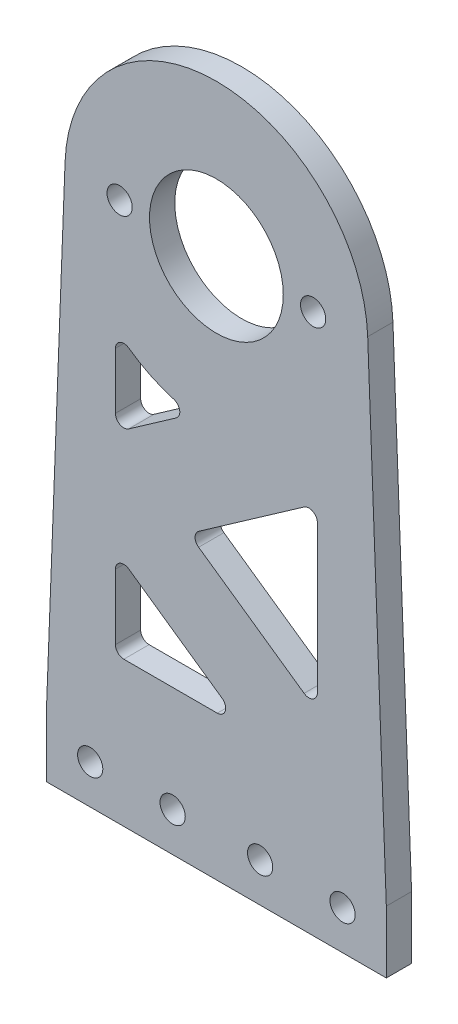
from build123d import *

# Parameters (mm, degrees)
SKETCH1_R               = 1.5
SKETCH1_R_2             = 7.95
MAIN_BODY_LINK_B1_DEPTH = 3
CUT_EXTRUDE1_REACH      = 168.945
CUT_EXTRUDE2_REACH      = 168.945
SKETCH3_R               = 1.5
FILLET1_R               = 1


with BuildPart() as part:
    # Sketch1 → Main Body Link B1 (new body)
    with BuildSketch(Plane.XY):
        with BuildLine():
            Line((-11.1, 83.474052381), (-9.1, 83.474052381))
            Line((-9.1, 83.474052381), (0, 83.474052381))
            Line((0, 83.474052381), (9.1, 83.474052381))
            Line((9.1, 83.474052381), (11.1, 83.474052381))
            Line((11.1, 83.474052381), (20.2, 83.474052381))
            Line((20.2, 83.474052381), (20.2, 90.874052381))
            Line((20.2, 90.874052381), (17.986683974, 148.383116621))
            ThreePointArc((17.986683974, 148.383116621), (0, 165.690874165), (-17.986683974, 148.383116621))
            Line((-17.986683974, 148.383116621), (-20.2, 90.874052381))
            Line((-20.2, 90.874052381), (-20.2, 83.474052381))
            Line((-20.2, 83.474052381), (-11.1, 83.474052381))
        make_face()
        with Locations((5.2, 88.124052381)):
            Circle(SKETCH1_R, mode=Mode.SUBTRACT)
        with Locations((15, 88.124052381)):
            Circle(SKETCH1_R, mode=Mode.SUBTRACT)
        with Locations((-15, 88.124052381)):
            Circle(SKETCH1_R, mode=Mode.SUBTRACT)
        with Locations((-5.2, 88.124052381)):
            Circle(SKETCH1_R, mode=Mode.SUBTRACT)
        with Locations((0, 147.690874165)):
            Circle(SKETCH1_R_2, mode=Mode.SUBTRACT)
    extrude(amount=MAIN_BODY_LINK_B1_DEPTH)

    # Sketch2 → Cut-Extrude1 (cut, up to next)
    with BuildSketch(Plane.XY.offset(3), mode=Mode.PRIVATE) as cut_extrude1_sk1:
        with BuildLine():
            ThreePointArc((-2.929911079, 129.930929878), (-7.774454217, 131.456408925), (-12, 134.2744663))
            Line((-12, 134.2744663), (-12, 123.584968066))
            Line((-12, 123.584968066), (-2.929911079, 129.930929878))
        make_face()
    cut_extrude1_tool1 = extrude(cut_extrude1_sk1.sketch, amount=-CUT_EXTRUDE1_REACH, mode=Mode.PRIVATE) & part.part
    # Sketch2 → Cut-Extrude1 (cut, up to next)
    with BuildSketch(Plane.XY.offset(3), mode=Mode.PRIVATE) as cut_extrude1_sk2:
        Polygon((-12, 111.380372399), (-12, 100.690874165), (3.278172542, 100.690874165), align=None)
    cut_extrude1_tool2 = extrude(cut_extrude1_sk2.sketch, amount=-CUT_EXTRUDE1_REACH, mode=Mode.PRIVATE) & part.part
    # Sketch2 → Cut-Extrude1 (cut, up to next)
    with BuildSketch(Plane.XY.offset(3), mode=Mode.PRIVATE) as cut_extrude1_sk3:
        Polygon((12, 106.793171999), (12, 128.172168466), (-3.278172542, 117.482670232), align=None)
    cut_extrude1_tool3 = extrude(cut_extrude1_sk3.sketch, amount=-CUT_EXTRUDE1_REACH, mode=Mode.PRIVATE) & part.part
    add(cut_extrude1_tool1.solids().sort_by_distance((-9.12997, 128.978342, 3))[0], mode=Mode.SUBTRACT)
    add(cut_extrude1_tool2.solids().sort_by_distance((-6.907276, 104.25404, 3))[0], mode=Mode.SUBTRACT)
    add(cut_extrude1_tool3.solids().sort_by_distance((6.907276, 117.48267, 3))[0], mode=Mode.SUBTRACT)

    # Sketch3 → Cut-Extrude2 (cut, up to next)
    with BuildSketch(Plane.XY.offset(3), mode=Mode.PRIVATE) as cut_extrude2_sk1:
        with Locations((-11.5, 147.690874165)):
            Circle(SKETCH3_R)
    cut_extrude2_tool1 = extrude(cut_extrude2_sk1.sketch, amount=-CUT_EXTRUDE2_REACH, mode=Mode.PRIVATE) & part.part
    # Sketch3 → Cut-Extrude2 (cut, up to next)
    with BuildSketch(Plane.XY.offset(3), mode=Mode.PRIVATE) as cut_extrude2_sk2:
        with Locations((11.5, 147.690874165)):
            Circle(SKETCH3_R)
    cut_extrude2_tool2 = extrude(cut_extrude2_sk2.sketch, amount=-CUT_EXTRUDE2_REACH, mode=Mode.PRIVATE) & part.part
    add(cut_extrude2_tool1.solids().sort_by_distance((-11.5, 147.690874, 3))[0], mode=Mode.SUBTRACT)
    add(cut_extrude2_tool2.solids().sort_by_distance((11.5, 147.690874, 3))[0], mode=Mode.SUBTRACT)

    # Fillet1
    fillet1_edges = [part.edges().sort_by_distance(p)[0] for p in [
        (-12, 100.690874165, 1.5),
        (3.278172542, 100.690874165, 1.5),
        (-12, 111.380372399, 1.5),
        (12, 106.793171999, 1.5),
        (12, 128.172168466, 1.5),
        (-3.278172542, 117.482670232, 1.5),
        (-12, 123.584968066, 1.5),
        (-2.929911079, 129.930929878, 1.5),
        (-12, 134.2744663, 1.5),
    ]]
    fillet(fillet1_edges, radius=FILLET1_R)


solid = part.part
